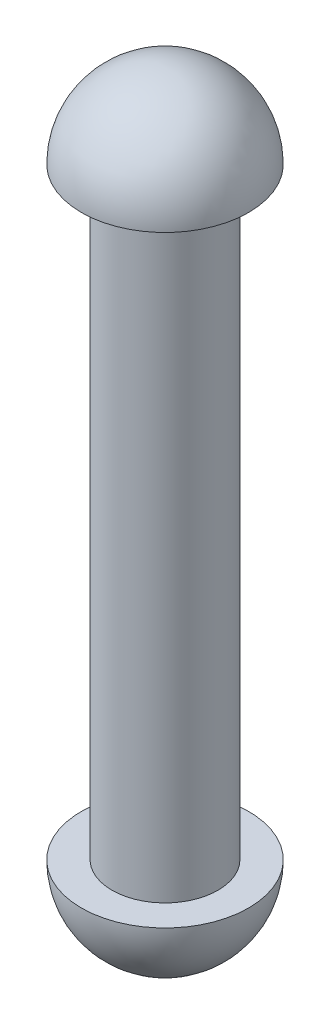
from build123d import *


with BuildPart() as part:
    # Sketch1 → Revolve1 (revolve)
    with BuildSketch(Plane.XY, mode=Mode.PRIVATE) as revolve1_sk:
        with BuildLine():
            ThreePointArc((0, -246), (-21.213203436, -237.213203436), (-30, -216))
            Line((-30, -216), (-19, -216))
            Line((-19, -216), (-19, 0))
            Line((-19, 0), (-30, 0))
            ThreePointArc((-30, 0), (-21.213203436, 21.213203436), (0, 30))
            Line((0, 30), (0, 0))
            Line((0, 0), (0, -216))
            Line((0, -216), (0, -246))
        make_face()
    revolve(revolve1_sk.sketch.rotate(Axis((0, 0, 0), (0, -1, 0)), 180), axis=Axis((0, 0, 0), (0, -1, 0)))


solid = part.part
